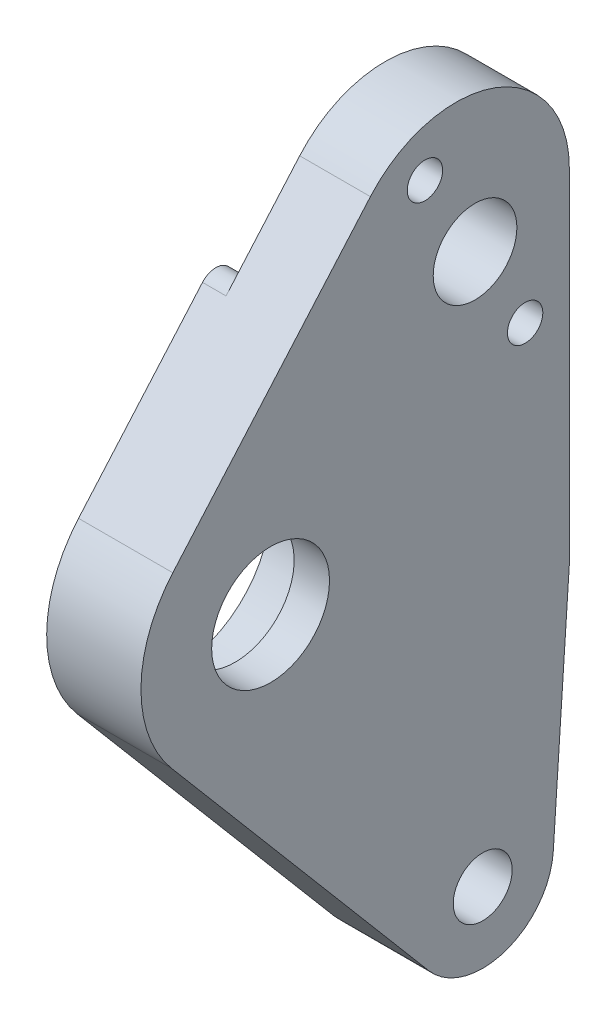
from build123d import *

# Parameters (mm, degrees)
SKETCH27_R                  = 3.55
SKETCH27_R_2                = 5
SKETCH27_R_3                = 2.5
BOSS_EXTRUDE1_DEPTH         = 8
TAP_DRILL_FOR_M3_TAP2_D     = 2.5
TAP_DRILL_FOR_M3_TAP2_DEPTH = 10
TAP_DRILL_FOR_M3_TAP2_TIP   = 0.751075774
SKETCH47_R                  = 7.99
CUT_EXTRUDE8_DEPTH          = 5
CUT_EXTRUDE10_DEPTH         = 2
CUT_EXTRUDE11_REACH         = 78.755
SKETCH49_R                  = 1.5


with BuildPart() as part:
    # Sketch27 → Boss-Extrude1 (new body)
    with BuildSketch(Plane(origin=(0, 0, 0), x_dir=(0, 0, -1), z_dir=(1, 0, 0))):
        with BuildLine():
            Line((3.703427373, 44.222664512), (20.469158548, 63.481222917))
            ThreePointArc((20.469158548, 63.481222917), (31.099959488, 66.174951681), (37.349351573, 57.163003953))
            Line((37.349351573, 57.163003953), (37.349351573, 28))
            Line((37.349351573, 28), (35.98665831, 7.600097167))
            ThreePointArc((35.98665831, 7.600097167), (31.875470614, 2.300648285), (25.420672816, 4.12317623))
            Line((25.420672816, 4.12317623), (3.604566829, 29.892489756))
            ThreePointArc((3.604566829, 29.892489756), (1.000261752, 37.075884637), (3.703427373, 44.222664512))
        make_face()
        with Locations((29.349351573, 55)):
            Circle(SKETCH27_R, mode=Mode.SUBTRACT)
        with Locations((12, 37)):
            Circle(SKETCH27_R_2, mode=Mode.SUBTRACT)
        with Locations((30, 8)):
            Circle(SKETCH27_R_3, mode=Mode.SUBTRACT)
    extrude(amount=BOSS_EXTRUDE1_DEPTH)

    # Tap Drill for M3 Tap2
    with Locations(Plane(origin=(0, 0, -37.349351573), x_dir=(-1, 0, 0), z_dir=(0, 0, -1))):
        with Locations((-5, 44), (-5, 32)):
            Hole(TAP_DRILL_FOR_M3_TAP2_D / 2, depth=TAP_DRILL_FOR_M3_TAP2_DEPTH)
            with Locations((0, 0, -(TAP_DRILL_FOR_M3_TAP2_DEPTH + TAP_DRILL_FOR_M3_TAP2_TIP / 2))):  # 118° drill point
                Cone(0, TAP_DRILL_FOR_M3_TAP2_D / 2, TAP_DRILL_FOR_M3_TAP2_TIP, mode=Mode.SUBTRACT)

    # Sketch47 → Cut-Extrude8 (cut)
    with BuildSketch(Plane.ZY):
        with Locations((-12, 37)):
            Circle(SKETCH47_R)
    extrude(amount=-CUT_EXTRUDE8_DEPTH, mode=Mode.SUBTRACT)

    # Sketch48 → Cut-Extrude10 (cut)
    with BuildSketch(Plane.ZY):
        with BuildLine():
            Line((-37.349351573, 42.600403232), (-37.349351573, 72.646655563))
            Line((-37.349351573, 72.646655563), (-14.22165601, 72.646655563))
            Line((-14.22165601, 72.646655563), (-14.22165601, 56.304805064))
            ThreePointArc((-14.22165601, 56.304805064), (-15.894843611, 56.718614571), (-16.852615188, 55.285621667))
            ThreePointArc((-16.852615188, 55.285621667), (-22.758204677, 44.378946258), (-35.152923001, 43.928931457))
            ThreePointArc((-35.152923001, 43.928931457), (-36.625675327, 43.883883434), (-37.349351573, 42.600403232))
        make_face()
    extrude(amount=-CUT_EXTRUDE10_DEPTH, mode=Mode.SUBTRACT)

    # Sketch49 → Cut-Extrude11 (cut, up to next)
    with BuildSketch(Plane.ZY.offset(-2), mode=Mode.PRIVATE) as cut_extrude11_sk1:
        with Locations((-33.599351573, 47.638784068)):
            Circle(SKETCH49_R)
    cut_extrude11_tool1 = extrude(cut_extrude11_sk1.sketch, amount=-CUT_EXTRUDE11_REACH, mode=Mode.PRIVATE) & part.part
    # Sketch49 → Cut-Extrude11 (cut, up to next)
    with BuildSketch(Plane.ZY.offset(-2), mode=Mode.PRIVATE) as cut_extrude11_sk2:
        with Locations((-25.099351573, 62.361215932)):
            Circle(SKETCH49_R)
    cut_extrude11_tool2 = extrude(cut_extrude11_sk2.sketch, amount=-CUT_EXTRUDE11_REACH, mode=Mode.PRIVATE) & part.part
    add(cut_extrude11_tool1.solids().sort_by_distance((2, 47.638784, -33.599352))[0], mode=Mode.SUBTRACT)
    add(cut_extrude11_tool2.solids().sort_by_distance((2, 62.361216, -25.099352))[0], mode=Mode.SUBTRACT)


solid = part.part
